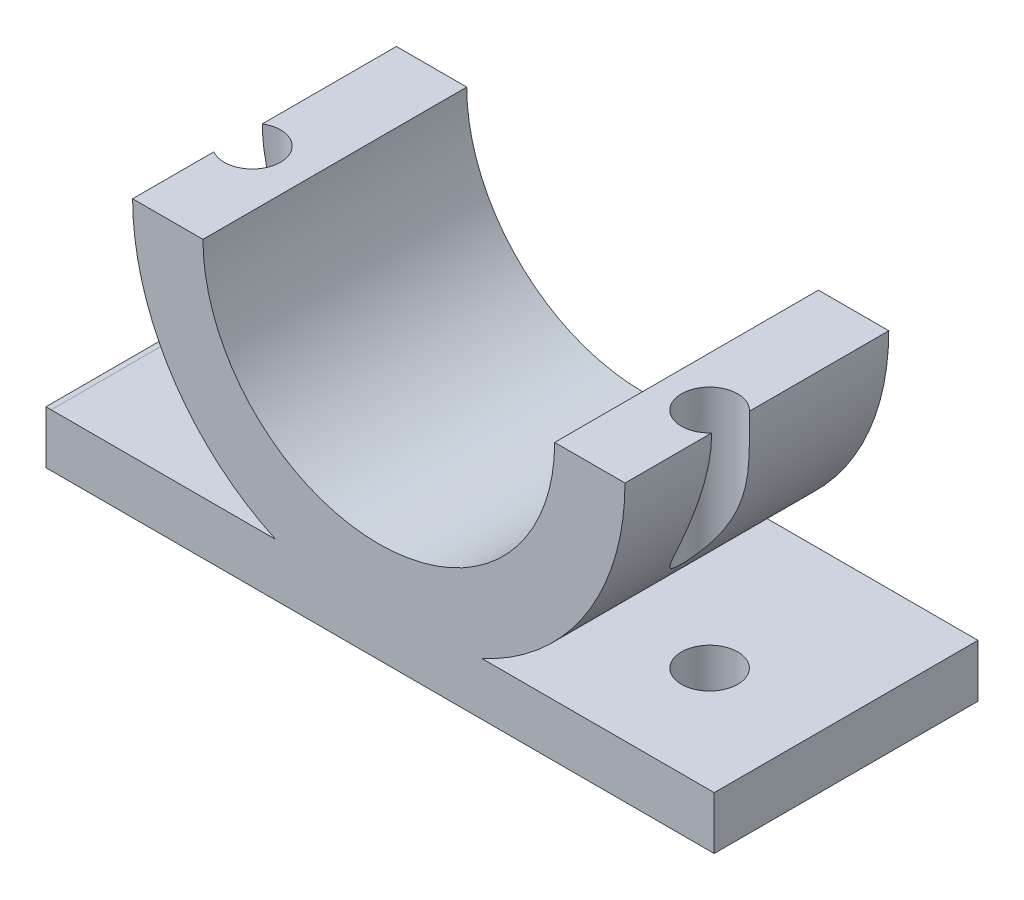
from build123d import *

# Parameters (mm, degrees)
EXTRUDE_1_DEPTH          = 15
CUT_EXTRUDE_1_DEPTH      = 28.393120676
CUT_EXTRUDE_1_DEPTH_BACK = 28.393120676
SKETCH_2_R               = 1.6


with BuildPart() as part:
    # 草图1 → 凸台-拉伸1 (new body)
    with BuildSketch(Plane.XY):
        with BuildLine():
            Line((-18.631868928, -12.71063098), (-18.925857281, -12.705463728))
            Line((-18.925857281, -12.705463728), (-18.925857281, -15.71063098))
            Line((-18.925857281, -15.71063098), (19.074142719, -15.71063098))
            Line((19.074142719, -15.71063098), (19.074142719, -12.71063098))
            Line((19.074142719, -12.71063098), (5.86854838, -12.71063098))
            ThreePointArc((5.86854838, -12.71063098), (11.79321155, -7.544545138), (14, 0))
            Line((14, 0), (10, 0))
            ThreePointArc((10, 0), (0, -10), (-10, 0))
            Line((-10, 0), (-14, 0))
            ThreePointArc((-14, 0), (-11.79321155, -7.544545138), (-5.86854838, -12.71063098))
            Line((-5.86854838, -12.71063098), (-18.631868928, -12.71063098))
        make_face()
    extrude(amount=EXTRUDE_1_DEPTH)

    # 草图2 → 切除-拉伸1 (cut, two sides: drawn at the far end of the back side and taken through both)
    with BuildSketch(Plane(origin=(0, -12.71063098, 0), x_dir=(1, 0, 0), z_dir=(0, 1, 0)).offset(-CUT_EXTRUDE_1_DEPTH_BACK)):
        with Locations(Location((-13.190081146, -9, 0), (0, 0, 180))):
            Circle(SKETCH_2_R)
        with Locations(Location((12.809918854, -9, 0), (0, 0, 180))):
            Circle(SKETCH_2_R)
    extrude(amount=CUT_EXTRUDE_1_DEPTH + CUT_EXTRUDE_1_DEPTH_BACK, mode=Mode.SUBTRACT)


solid = part.part
